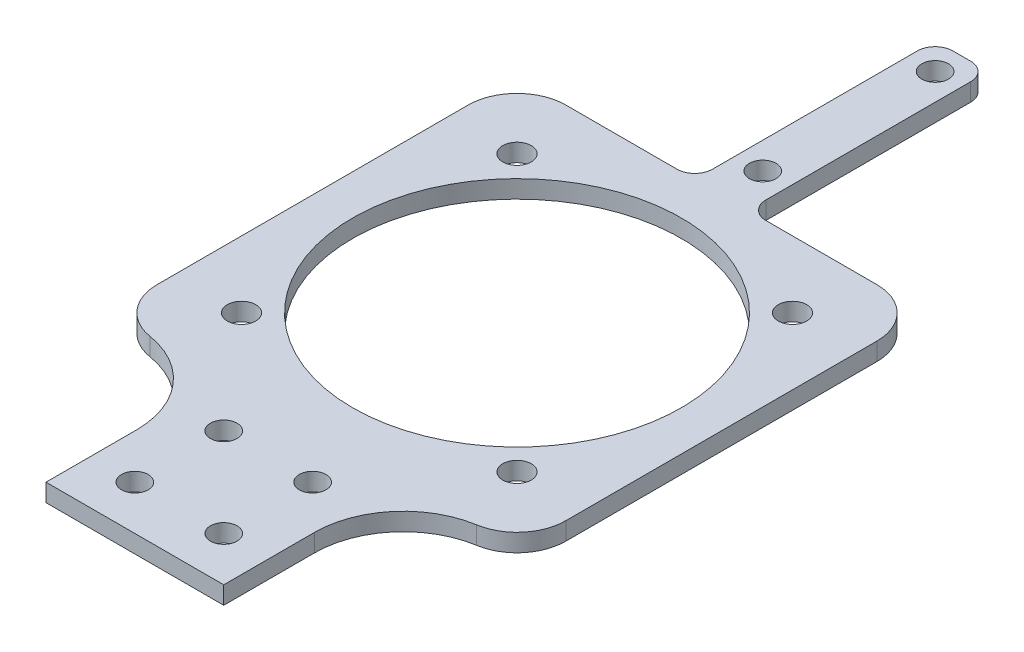
from build123d import *

# Parameters (mm, degrees)
SKETCH_2_W          = 46
SKETCH_2_H          = 46
SKETCH_2_R          = 18.5
EXTRUDE_1_DEPTH     = 2
FILLET_1_R          = 5.5
SKETCH_3_R          = 1.6
CUT_EXTRUDE_1_DEPTH = 33.588341474
SKETCH_4_W          = 20
SKETCH_4_H          = 20
SKETCH_4_R          = 1.5
EXTRUDE_2_DEPTH     = 2
SKETCH_5_W          = 6
SKETCH_5_H          = 27.4
SKETCH_5_R          = 1.5
EXTRUDE_3_DEPTH     = 2
FILLET_5_R          = 2
FILLET_6_R          = 10


with BuildPart() as part:
    # 草图2 → 凸台-拉伸1 (new body)
    with BuildSketch(Plane(origin=(0, 0, 0), x_dir=(1, 0, 0), z_dir=(0, 1, 0))):
        Rectangle(SKETCH_2_W, SKETCH_2_H)
        with Locations(Location((0, 0, 0), (0, 0, 270))):
            Circle(SKETCH_2_R, mode=Mode.SUBTRACT)
    extrude(amount=EXTRUDE_1_DEPTH)

    # 圆角1
    fillet_1_edges = [part.edges().sort_by_distance(p)[0] for p in [
        (23, 1, 23),
        (-23, 1, 23),
        (-23, 1, -23),
        (23, 1, -23),
    ]]
    fillet(fillet_1_edges, radius=FILLET_1_R)

    # 草图3 → 切除-拉伸1 (cut, through all)
    with BuildSketch(Plane(origin=(0, 2, 0), x_dir=(1, 0, 0), z_dir=(0, 1, 0))):
        with Locations(Location((-15.5, 15.5, 0), (0, 0, 270))):
            Circle(SKETCH_3_R)
        with Locations(Location((15.5, 15.5, 0), (0, 0, 270))):
            Circle(SKETCH_3_R)
        with Locations(Location((-15.5, -15.5, 0), (0, 0, 270))):
            Circle(SKETCH_3_R)
        with Locations(Location((15.5, -15.5, 0), (0, 0, 270))):
            Circle(SKETCH_3_R)
    extrude(amount=-CUT_EXTRUDE_1_DEPTH, mode=Mode.SUBTRACT)

    # 草图4 → 凸台-拉伸2 (add)
    with BuildSketch(Plane(origin=(0, 2, 0), x_dir=(1, 0, 0), z_dir=(0, 1, 0))):
        with Locations((0, -33)):
            Rectangle(SKETCH_4_W, SKETCH_4_H)
        with Locations(Location((-5, -38, 0), (0, 0, 270))):
            Circle(SKETCH_4_R, mode=Mode.SUBTRACT)
        with Locations(Location((5, -38, 0), (0, 0, 270))):
            Circle(SKETCH_4_R, mode=Mode.SUBTRACT)
        with Locations(Location((-5, -28, 0), (0, 0, 270))):
            Circle(SKETCH_4_R, mode=Mode.SUBTRACT)
        with Locations(Location((5, -28, 0), (0, 0, 270))):
            Circle(SKETCH_4_R, mode=Mode.SUBTRACT)
    extrude(amount=-EXTRUDE_2_DEPTH)

    # 草图5 → 凸台-拉伸3 (add)
    with BuildSketch(Plane(origin=(0, 2, 0), x_dir=(1, 0, 0), z_dir=(0, 1, 0))):
        with Locations((0, 36.350013022)):
            Rectangle(SKETCH_5_W, SKETCH_5_H)
        with Locations(Location((0, 47.050013022, 0), (0, 0, 270))):
            Circle(SKETCH_5_R, mode=Mode.SUBTRACT)
        with Locations(Location((0, 27.650013022, 0), (0, 0, 270))):
            Circle(SKETCH_5_R, mode=Mode.SUBTRACT)
    extrude(amount=-EXTRUDE_3_DEPTH)

    # 圆角5
    fillet_5_edges = [part.edges().sort_by_distance(p)[0] for p in [
        (-3, 1, -50.050013022),
        (3, 1, -50.050013022),
        (3, 1, -23),
        (-3, 1, -23),
    ]]
    fillet(fillet_5_edges, radius=FILLET_5_R)

    # 圆角6
    fillet_6_edges = [part.edges().sort_by_distance(p)[0] for p in [
        (10, 1, 23),
        (-10, 1, 23),
    ]]
    fillet(fillet_6_edges, radius=FILLET_6_R)


solid = part.part
